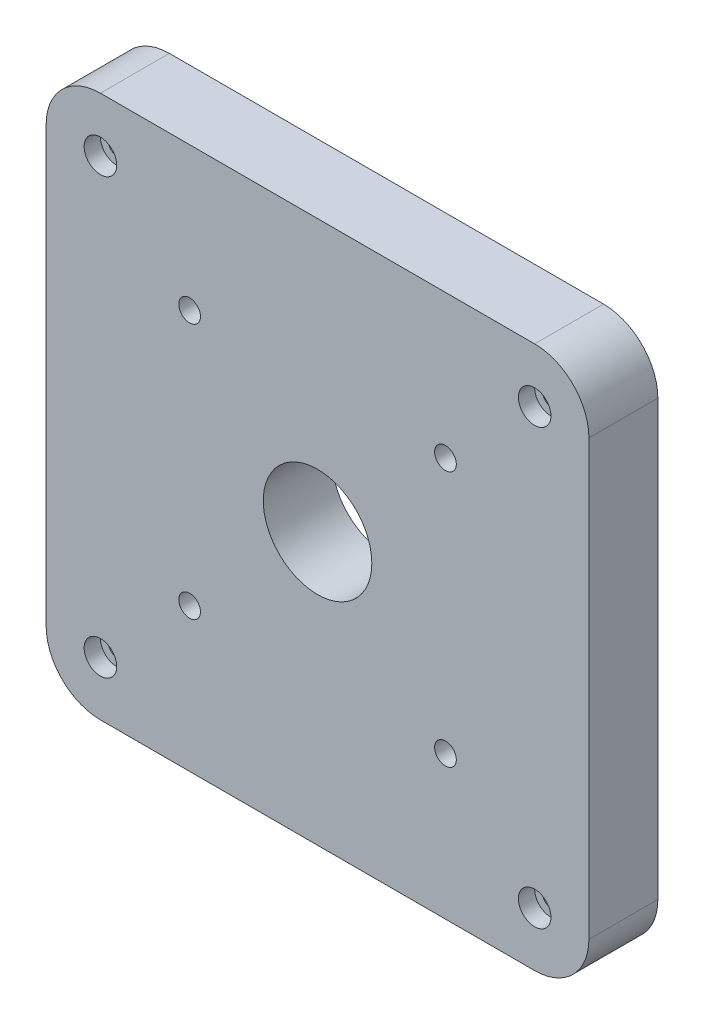
from build123d import *

# Parameters (mm, degrees)
SALIENTE_EXTRUIR4_START = 70
SALIENTE_EXTRUIR4_DEPTH = 12.7
CROQUIS8_R              = 3
CORTAR_EXTRUIR1_DEPTH   = 3
CROQUIS13_R             = 1.5
CORTAR_EXTRUIR4_DEPTH   = 30
CROQUIS16_R             = 10
CROQUIS16_R_2           = 2
CORTAR_EXTRUIR6_DEPTH   = 31
CROQUIS21_R             = 4
CORTAR_EXTRUIR12_DEPTH  = 4.5


with BuildPart() as part:
    # Croquis5 → Saliente-Extruir4 (new body)
    with BuildSketch(Plane.XY.offset(12.7).offset(SALIENTE_EXTRUIR4_START)):
        with BuildLine():
            Line((160, 0), (80, 0))
            ThreePointArc((80, 0), (72.928932188, 2.928932188), (70, 10))
            Line((70, 10), (70, 90))
            ThreePointArc((70, 90), (72.928932188, 97.071067812), (80, 100))
            Line((80, 100), (160, 100))
            ThreePointArc((160, 100), (167.071067812, 97.071067812), (170, 90))
            Line((170, 90), (170, 10))
            ThreePointArc((170, 10), (167.071067812, 2.928932188), (160, 0))
        make_face()
    extrude(amount=SALIENTE_EXTRUIR4_DEPTH)

    # Croquis8 → Cortar-Extruir1 (cut)
    with BuildSketch(Plane.XY.offset(95.4)):
        with Locations((80, 90)):
            Circle(CROQUIS8_R)
        with Locations((160, 90)):
            Circle(CROQUIS8_R)
        with Locations((160, 10)):
            Circle(CROQUIS8_R)
        with Locations((80, 10)):
            Circle(CROQUIS8_R)
    extrude(amount=-CORTAR_EXTRUIR1_DEPTH, mode=Mode.SUBTRACT)

    # Croquis13 → Cortar-Extruir4 (cut)
    with BuildSketch(Plane.XY.offset(95.4)):
        with Locations((80, 90)):
            Circle(CROQUIS13_R)
        with Locations((160, 90)):
            Circle(CROQUIS13_R)
        with Locations((160, 10)):
            Circle(CROQUIS13_R)
        with Locations((80, 10)):
            Circle(CROQUIS13_R)
    extrude(amount=-CORTAR_EXTRUIR4_DEPTH, mode=Mode.SUBTRACT)

    # Croquis16 → Cortar-Extruir6 (cut)
    with BuildSketch(Plane.XY.offset(95.4)):
        with Locations((120, 50)):
            Circle(CROQUIS16_R)
        with Locations((96.43, 73.57)):
            Circle(CROQUIS16_R_2)
        with Locations((143.57, 73.57)):
            Circle(CROQUIS16_R_2)
        with Locations((96.43, 26.43)):
            Circle(CROQUIS16_R_2)
        with Locations((143.57, 26.43)):
            Circle(CROQUIS16_R_2)
    extrude(amount=-CORTAR_EXTRUIR6_DEPTH, mode=Mode.SUBTRACT)

    # Croquis21 → Cortar-Extruir12 (cut)
    with BuildSketch(Plane(origin=(0, 0, 82.7), x_dir=(-1, 0, 0), z_dir=(0, 0, -1))):
        with Locations((-143.57, 73.57)):
            Circle(CROQUIS21_R)
        with Locations((-96.43, 73.57)):
            Circle(CROQUIS21_R)
        with Locations((-143.57, 26.43)):
            Circle(CROQUIS21_R)
        with Locations((-96.43, 26.43)):
            Circle(CROQUIS21_R)
    extrude(amount=-CORTAR_EXTRUIR12_DEPTH, mode=Mode.SUBTRACT)


solid = part.part
